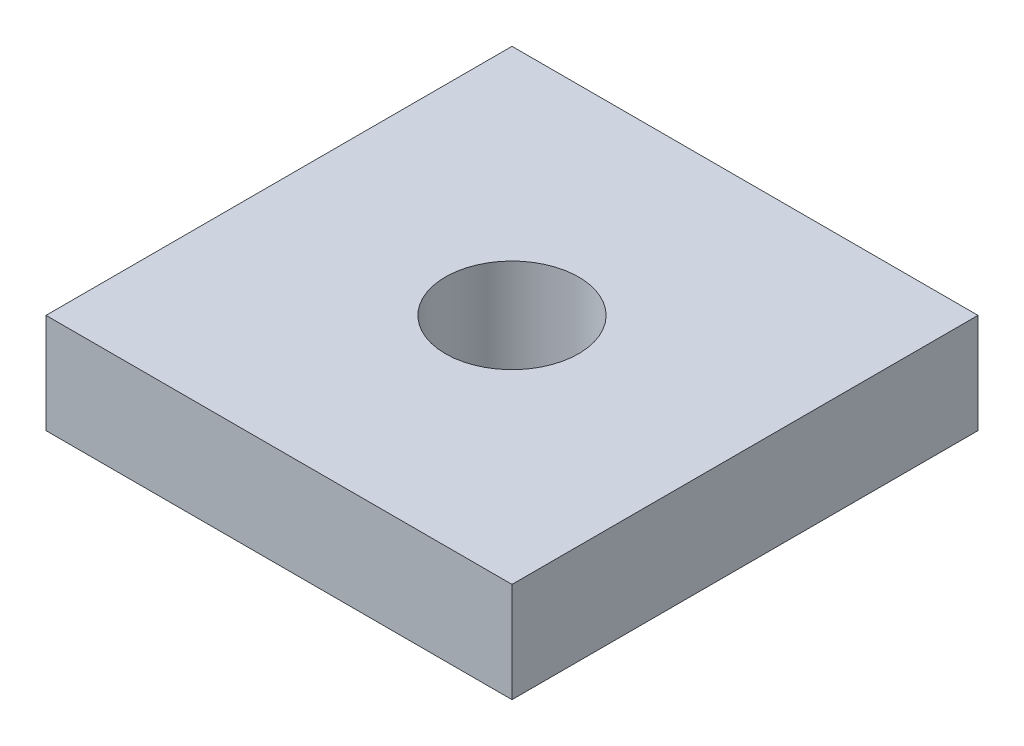
from build123d import *

# Parameters (mm, degrees)
SKETCH1_W          = 44.45
SKETCH1_H          = 44.45
EXTRUDE1_DEPTH     = 9.525
SKETCH3_R          = 6.35
CUT_EXTRUDE1_DEPTH = 9.525


with BuildPart() as part:
    # Sketch1 → Extrude1 (new body)
    with BuildSketch(Plane(origin=(0, 0, 0), x_dir=(1, 0, 0), z_dir=(0, 1, 0))):
        with Locations((22.225, -22.225)):
            Rectangle(SKETCH1_W, SKETCH1_H)
    extrude(amount=EXTRUDE1_DEPTH)

    # Sketch3 → Cut-Extrude1 (cut)
    with BuildSketch(Plane(origin=(0, 9.525, 0), x_dir=(-1, 0, 0), z_dir=(0, 1, 0))):
        with Locations(Location((-22.225, 22.225, 0), (0, 0, 90))):
            Circle(SKETCH3_R)
    extrude(amount=-CUT_EXTRUDE1_DEPTH, mode=Mode.SUBTRACT)


solid = part.part
